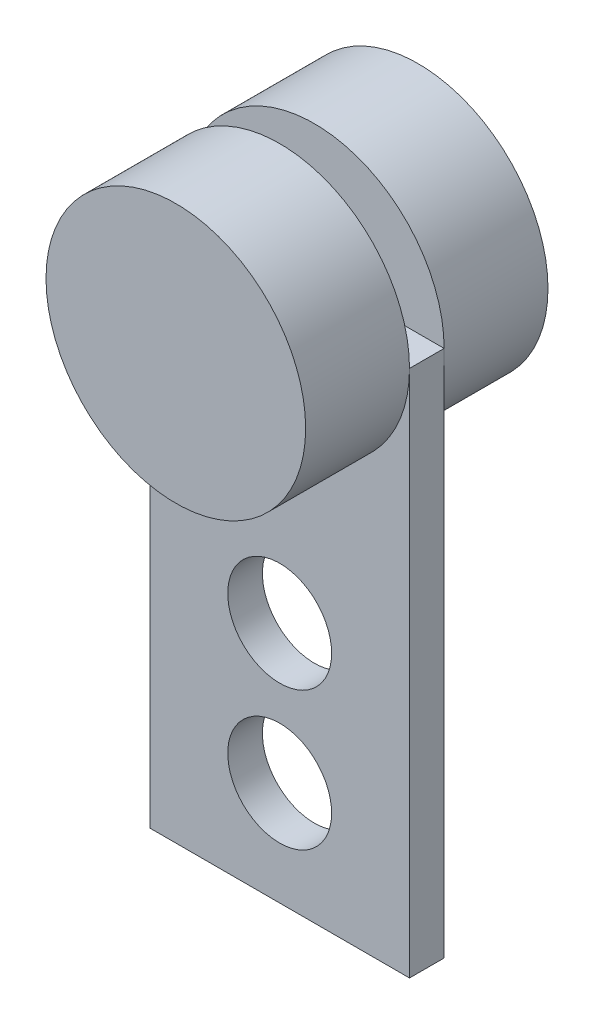
from build123d import *

# Parameters (mm, degrees)
SZKIC1_W                    = 15
SZKIC1_H                    = 30.5
SZKIC1_R                    = 3
DODANIE_WYCI_GNI_CIE1_DEPTH = 2
SZKIC2_R                    = 7.5
DODANIE_WYCI_GNI_CIE2_DEPTH = 6
DODANIE_WYCI_GNI_CIE3_START = -8
SZKIC2_2_R                  = 7.5
DODANIE_WYCI_GNI_CIE3_DEPTH = 6


with BuildPart() as part:
    # Szkic1 → Dodanie-wyciągnięcie1 (new body)
    with BuildSketch(Plane.XY):
        Rectangle(SZKIC1_W, SZKIC1_H)
        with Locations((0, -9.25)):
            Circle(SZKIC1_R, mode=Mode.SUBTRACT)
        with Locations((0, -1.25)):
            Circle(SZKIC1_R, mode=Mode.SUBTRACT)
    extrude(amount=DODANIE_WYCI_GNI_CIE1_DEPTH)

    # Szkic2 → Dodanie-wyciągnięcie2 (add)
    with BuildSketch(Plane.XY.offset(2)):
        with Locations((0, 15.25)):
            Circle(SZKIC2_R)
    extrude(amount=DODANIE_WYCI_GNI_CIE2_DEPTH)

    # Szkic2<2> → Dodanie-wyciągnięcie3 (add)
    with BuildSketch(Plane.XY.offset(2).offset(DODANIE_WYCI_GNI_CIE3_START)):
        with Locations((0, 15.25)):
            Circle(SZKIC2_2_R)
    extrude(amount=DODANIE_WYCI_GNI_CIE3_DEPTH)


solid = part.part
